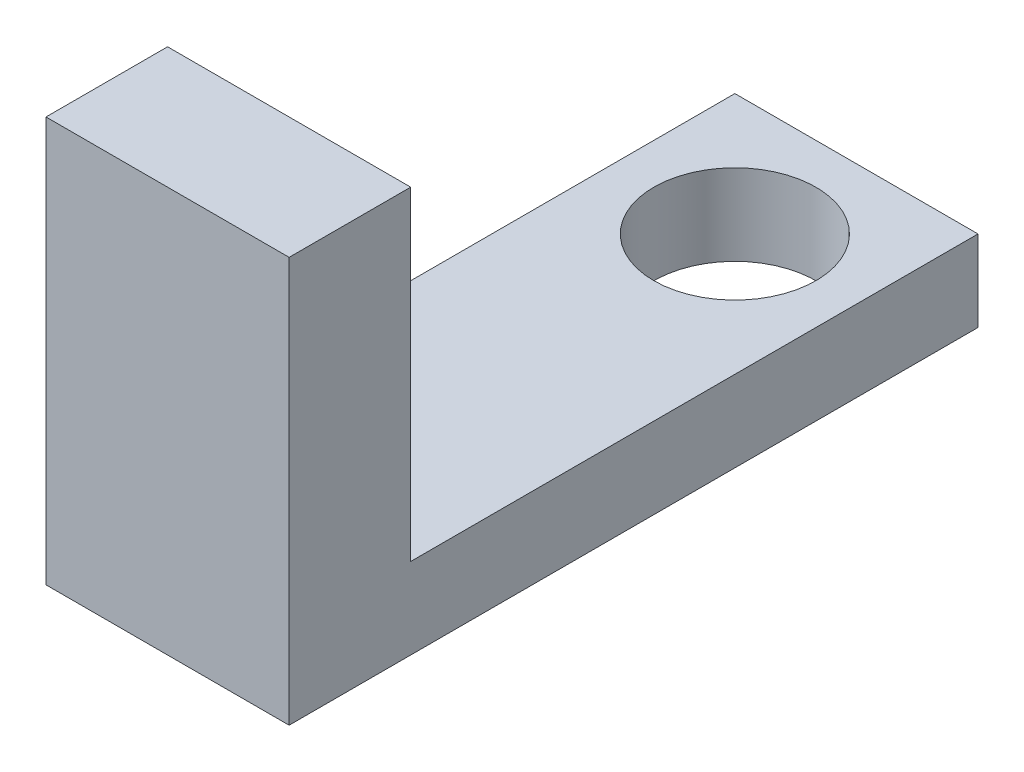
from build123d import *

# Parameters (mm, degrees)
BOSS_EXTRUDE1_DEPTH = 30
SKETCH2_R           = 10
CUT_EXTRUDE1_DEPTH  = 10


with BuildPart() as part:
    # Sketch1 → Boss-Extrude1 (new body)
    with BuildSketch(Plane(origin=(0, 0, 0), x_dir=(0, 0, -1), z_dir=(1, 0, 0))):
        Polygon((0, 40), (0, 0), (70, 0), (70, -10), (-15, -10), (-15, 40), align=None)
    extrude(amount=BOSS_EXTRUDE1_DEPTH)

    # Sketch2 → Cut-Extrude1 (cut)
    with BuildSketch(Plane(origin=(0, 0, 0), x_dir=(1, 0, 0), z_dir=(0, 1, 0))):
        with Locations(Location((15, 55, 0), (0, 0, 270))):
            Circle(SKETCH2_R)
    extrude(amount=-CUT_EXTRUDE1_DEPTH, mode=Mode.SUBTRACT)


solid = part.part
